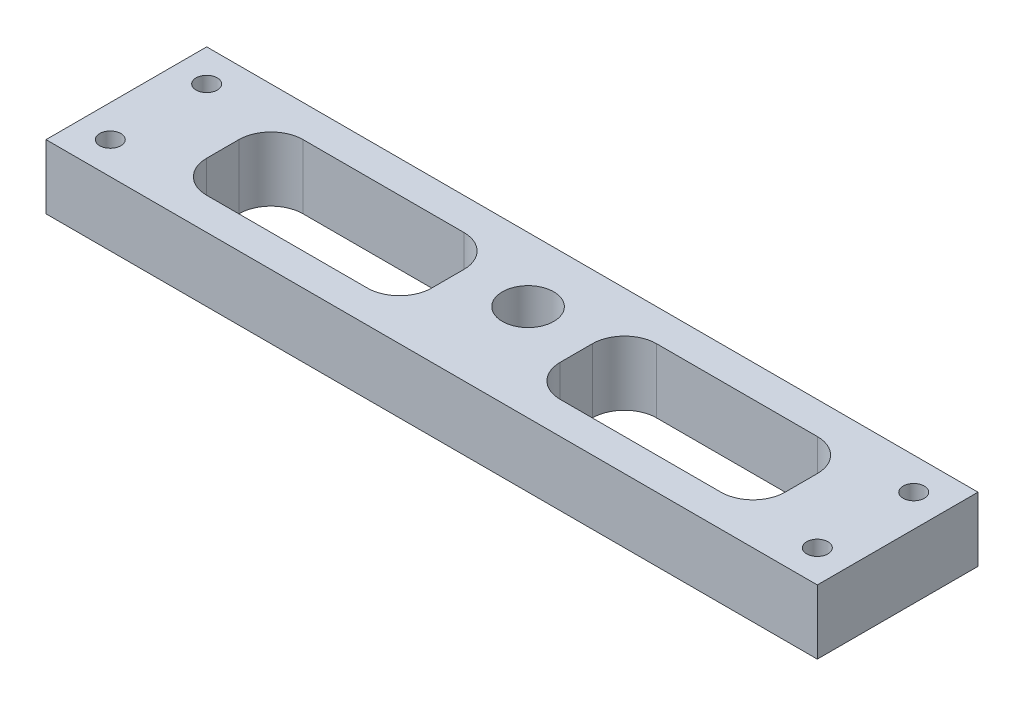
from build123d import *

# Parameters (mm, degrees)
SKETCH1_W             = 119.999999984
SKETCH1_H             = 25.000000005
SKETCH1_R             = 4
SKETCH1_W_2           = 34.999999984
SKETCH1_H_2           = 15.000000005
SKETCH1_W_3           = 35.000000016
BOSS_EXTRUDE1_DEPTH   = 10
FILLET1_R             = 5
M4X0_7_TAPPED_HOLE1_D = 3.3


with BuildPart() as part:
    # Sketch1 → Boss-Extrude1 (new body)
    with BuildSketch(Plane(origin=(0, 0, 0), x_dir=(1, 0, 0), z_dir=(0, 1, 0))):
        with Locations((-59.999999992, -12.500000003)):
            Rectangle(SKETCH1_W, SKETCH1_H)
        with Locations(Location((-60, -10, 0), (0, 0, 270))):
            Circle(SKETCH1_R, mode=Mode.SUBTRACT)
        with Locations((-87.499999992, -12.500000003)):
            Rectangle(SKETCH1_W_2, SKETCH1_H_2, mode=Mode.SUBTRACT)
        with Locations((-32.499999992, -12.500000003)):
            Rectangle(SKETCH1_W_3, SKETCH1_H_2, mode=Mode.SUBTRACT)
    extrude(amount=BOSS_EXTRUDE1_DEPTH)

    # Fillet1
    fillet1_edges = [part.edges().sort_by_distance(p)[0] for p in [
        (-14.999999984, 5, 20.000000005),
        (-14.999999984, 5, 5),
        (-50, 5, 5),
        (-50, 5, 20.000000005),
        (-104.999999984, 5, 5),
        (-104.999999984, 5, 20.000000005),
        (-70, 5, 20.000000005),
        (-70, 5, 5),
    ]]
    fillet(fillet1_edges, radius=FILLET1_R)

    # M4x0.7 Tapped Hole1 (through all)
    with Locations(Plane(origin=(0, 10, 0), x_dir=(1, 0, 0), z_dir=(0, 1, 0))):
        with Locations((-115, -5), (-115, -20.000000005), (-5, -5), (-5, -20.000000005)):
            Hole(M4X0_7_TAPPED_HOLE1_D / 2)


solid = part.part
